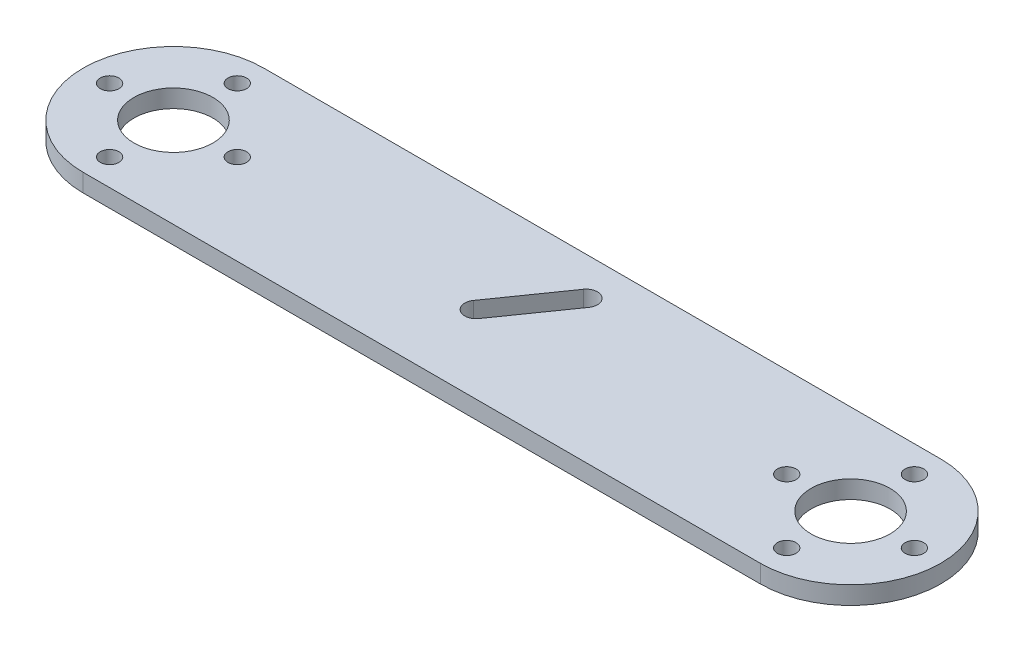
from build123d import *

# Parameters (mm, degrees)
SKETCH1_R           = 7
BOSS_EXTRUDE1_DEPTH = 3.175
SKETCH2_R           = 1.65
CUT_EXTRUDE1_DEPTH  = 10


with BuildPart() as part:
    # Sketch1 → Boss-Extrude1 (new body)
    with BuildSketch(Plane(origin=(0, 0, 0), x_dir=(1, 0, 0), z_dir=(0, 1, 0))):
        with BuildLine():
            Line((0, 0), (120, 0))
            ThreePointArc((120, 0), (136, 16), (120, 32))
            Line((120, 32), (0, 32))
            ThreePointArc((0, 32), (-16, 16), (0, 0))
        make_face()
        with Locations(Location((0, 16, 0), (0, 0, 270))):
            Circle(SKETCH1_R, mode=Mode.SUBTRACT)
        with Locations(Location((120, 16, 0), (0, 0, 270))):
            Circle(SKETCH1_R, mode=Mode.SUBTRACT)
        with BuildLine():
            Line((54.239251688, 14.910817765), (62.269321797, 26.378946385))
            ThreePointArc((62.269321797, 26.378946385), (65.054778758, 26.870097601), (65.545929974, 24.08464064))
            Line((65.545929974, 24.08464064), (57.515859865, 12.616512019))
            ThreePointArc((57.515859865, 12.616512019), (54.730402904, 12.125360804), (54.239251688, 14.910817765))
        make_face(mode=Mode.SUBTRACT)
    extrude(amount=BOSS_EXTRUDE1_DEPTH)

    # Sketch2 → Cut-Extrude1 (cut)
    with BuildSketch(Plane(origin=(0, 3.175, 0), x_dir=(1, 0, 0), z_dir=(0, 1, 0))):
        with Locations(Location((120, 27.313708499, 0), (0, 0, 270))):
            Circle(SKETCH2_R)
        with Locations(Location((108.686291501, 16, 0), (0, 0, 270))):
            Circle(SKETCH2_R)
        with Locations(Location((120, 4.686291501, 0), (0, 0, 270))):
            Circle(SKETCH2_R)
        with Locations(Location((131.313708499, 16, 0), (0, 0, 270))):
            Circle(SKETCH2_R)
        with Locations(Location((-11.313708499, 16, 0), (0, 0, 270))):
            Circle(SKETCH2_R)
        with Locations(Location((0, 27.313708499, 0), (0, 0, 270))):
            Circle(SKETCH2_R)
        with Locations(Location((11.313708499, 16, 0), (0, 0, 270))):
            Circle(SKETCH2_R)
        with Locations(Location((0, 4.686291501, 0), (0, 0, 270))):
            Circle(SKETCH2_R)
    extrude(amount=-CUT_EXTRUDE1_DEPTH, mode=Mode.SUBTRACT)


solid = part.part
